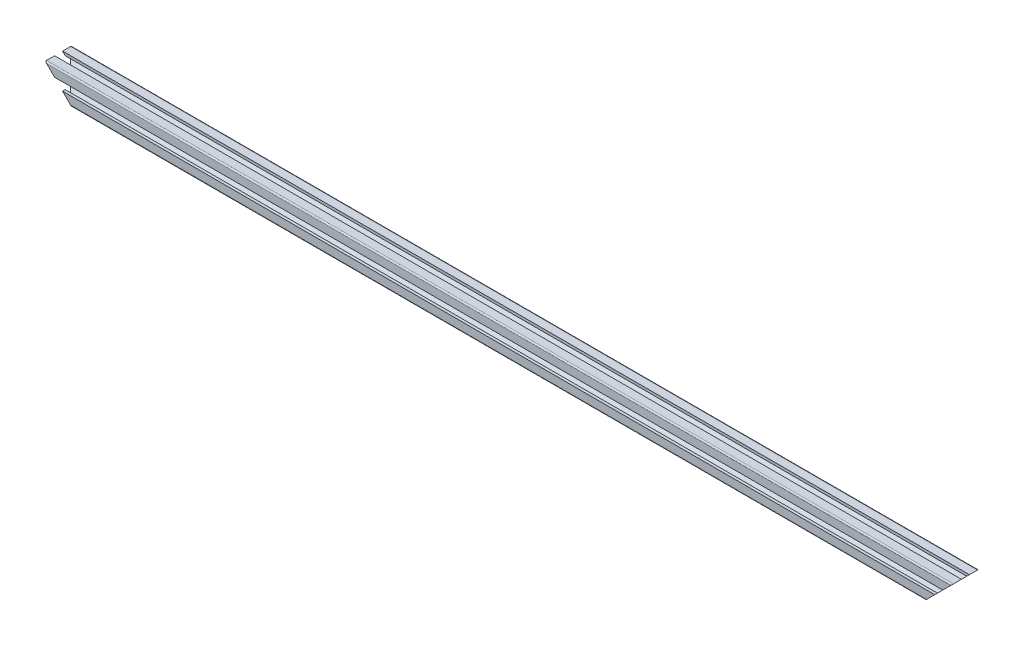
from build123d import *

# Parameters (mm, degrees)
SKETCH1_R           = 2.1
BOSS_EXTRUDE1_DEPTH = 680
CUT_EXTRUDE1_DEPTH  = 10
CUT_EXTRUDE2_DEPTH  = 10


with BuildPart() as part:
    # Sketch1 → Boss-Extrude1 (new body)
    with BuildSketch(Plane(origin=(0, 0, 0), x_dir=(0, 0, -1), z_dir=(1, 0, 0))):
        with BuildLine():
            Line((-10, 9), (-10, 3))
            Line((-10, 3), (-8, 3))
            Line((-8, 3), (-8, 6))
            Line((-8, 6), (-7.060660172, 6))
            Line((-7.060660172, 6), (-4, 2.939339828))
            Line((-4, 2.939339828), (-4, -2.939339828))
            Line((-4, -2.939339828), (-7.060660172, -6))
            Line((-7.060660172, -6), (-8, -6))
            Line((-8, -6), (-8, -3))
            Line((-8, -3), (-10, -3))
            Line((-10, -3), (-10, -9))
            ThreePointArc((-10, -9), (-9.707106781, -9.707106781), (-9, -10))
            Line((-9, -10), (-3, -10))
            Line((-3, -10), (-3, -8))
            Line((-3, -8), (-6, -8))
            Line((-6, -8), (-6, -7.060660172))
            Line((-6, -7.060660172), (-2.939339828, -4))
            Line((-2.939339828, -4), (2.939339828, -4))
            Line((2.939339828, -4), (6, -7.060660172))
            Line((6, -7.060660172), (6, -8))
            Line((6, -8), (3, -8))
            Line((3, -8), (3, -10))
            Line((3, -10), (9, -10))
            ThreePointArc((9, -10), (9.707106781, -9.707106781), (10, -9))
            Line((10, -9), (10, -3))
            Line((10, -3), (8, -3))
            Line((8, -3), (8, -6))
            Line((8, -6), (7.060660172, -6))
            Line((7.060660172, -6), (4, -2.939339828))
            Line((4, -2.939339828), (4, 2.939339828))
            Line((4, 2.939339828), (7.060660172, 6))
            Line((7.060660172, 6), (8, 6))
            Line((8, 6), (8, 3))
            Line((8, 3), (10, 3))
            Line((10, 3), (10, 9))
            ThreePointArc((10, 9), (9.707106781, 9.707106781), (9, 10))
            Line((9, 10), (3, 10))
            Line((3, 10), (3, 8))
            Line((3, 8), (6, 8))
            Line((6, 8), (6, 7.060660172))
            Line((6, 7.060660172), (2.939339828, 4))
            Line((2.939339828, 4), (-2.939339828, 4))
            Line((-2.939339828, 4), (-6, 7.060660172))
            Line((-6, 7.060660172), (-6, 8))
            Line((-6, 8), (-3, 8))
            Line((-3, 8), (-3, 10))
            Line((-3, 10), (-9, 10))
            ThreePointArc((-9, 10), (-9.707106781, 9.707106781), (-10, 9))
        make_face()
        Circle(SKETCH1_R, mode=Mode.SUBTRACT)
    extrude(amount=BOSS_EXTRUDE1_DEPTH)

    # Sketch28 → Cut-Extrude1 (cut, symmetric)
    with BuildSketch(Plane.XY):
        Polygon((0, 10), (0, -10), (20, -10), align=None)
    extrude(amount=CUT_EXTRUDE1_DEPTH, both=True, mode=Mode.SUBTRACT)

    # Sketch29 → Cut-Extrude2 (cut, symmetric)
    with BuildSketch(Plane.XY):
        Polygon((680, 10), (680, -10), (660, -10), align=None)
    extrude(amount=CUT_EXTRUDE2_DEPTH, both=True, mode=Mode.SUBTRACT)


solid = part.part
